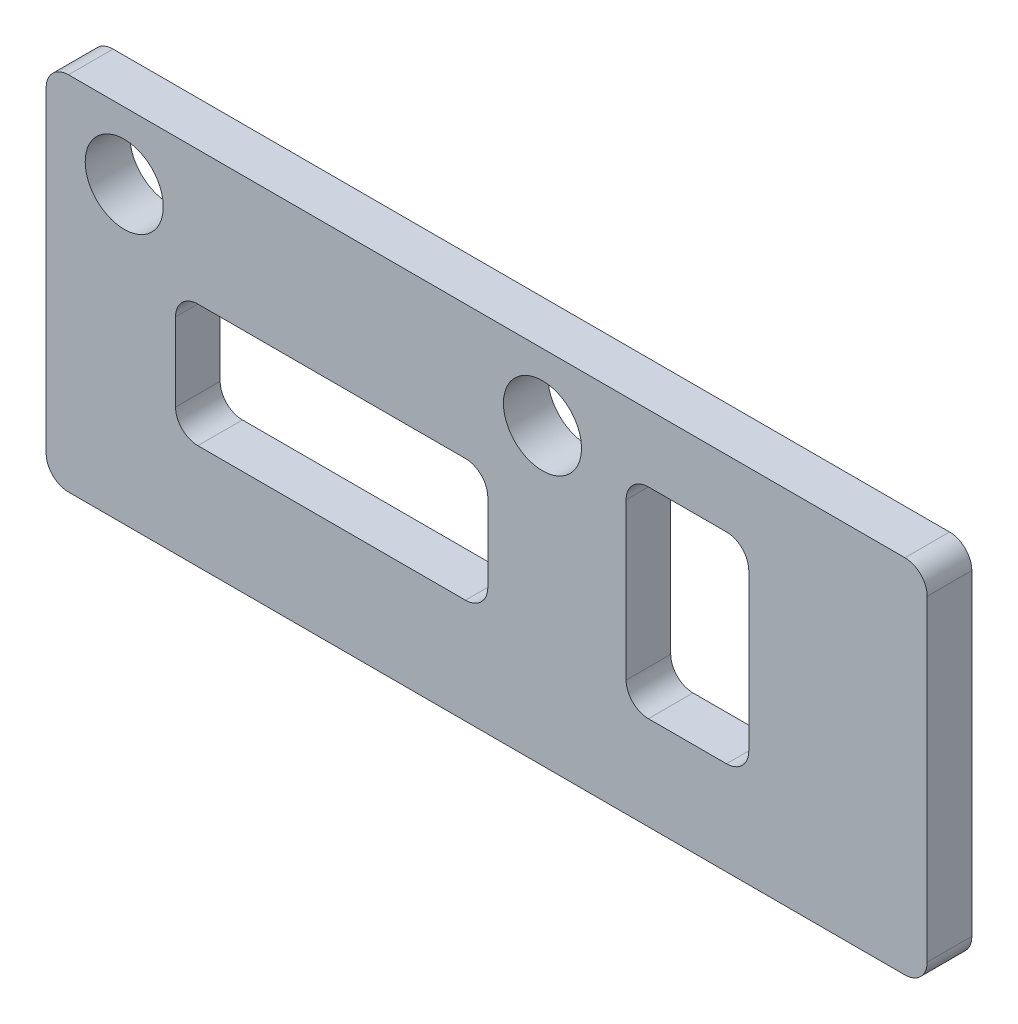
from build123d import *

# Parameters (mm, degrees)
SKETCH1_R           = 1.75
BOSS_EXTRUDE1_DEPTH = 2


with BuildPart() as part:
    # Sketch1 → Boss-Extrude1 (new body)
    with BuildSketch(Plane.XY):
        with BuildLine():
            Line((-19.75, 7.1), (-19.75, -7.1))
            ThreePointArc((-19.75, -7.1), (-19.457106781, -7.807106781), (-18.75, -8.1))
            Line((-18.75, -8.1), (18.75, -8.1))
            ThreePointArc((18.75, -8.1), (19.457106781, -7.807106781), (19.75, -7.1))
            Line((19.75, -7.1), (19.75, 7.1))
            ThreePointArc((19.75, 7.1), (19.457106781, 7.807106781), (18.75, 8.1))
            Line((18.75, 8.1), (-18.75, 8.1))
            ThreePointArc((-18.75, 8.1), (-19.457106781, 7.807106781), (-19.75, 7.1))
        make_face()
        with Locations(Location((-16.25, 5.1, 0), (0, 0, 180))):
            Circle(SKETCH1_R, mode=Mode.SUBTRACT)
        with Locations(Location((2.5, 5.1, 0), (0, 0, 180))):
            Circle(SKETCH1_R, mode=Mode.SUBTRACT)
        with BuildLine():
            Line((7.25, 5.1), (10.75, 5.1))
            ThreePointArc((10.75, 5.1), (11.457106781, 4.807106781), (11.75, 4.1))
            Line((11.75, 4.1), (11.75, -2.9))
            ThreePointArc((11.75, -2.9), (11.457106781, -3.607106781), (10.75, -3.9))
            Line((10.75, -3.9), (7.25, -3.9))
            ThreePointArc((7.25, -3.9), (6.542893219, -3.607106781), (6.25, -2.9))
            Line((6.25, -2.9), (6.25, 4.1))
            ThreePointArc((6.25, 4.1), (6.542893219, 4.807106781), (7.25, 5.1))
        make_face(mode=Mode.SUBTRACT)
        with BuildLine():
            Line((-12.95, 2.1), (-0.95, 2.1))
            ThreePointArc((-0.95, 2.1), (-0.242893219, 1.807106781), (0.05, 1.1))
            Line((0.05, 1.1), (0.05, -2.4))
            ThreePointArc((0.05, -2.4), (-0.242893219, -3.107106781), (-0.95, -3.4))
            Line((-0.95, -3.4), (-12.95, -3.4))
            ThreePointArc((-12.95, -3.4), (-13.657106781, -3.107106781), (-13.95, -2.4))
            Line((-13.95, -2.4), (-13.95, 1.1))
            ThreePointArc((-13.95, 1.1), (-13.657106781, 1.807106781), (-12.95, 2.1))
        make_face(mode=Mode.SUBTRACT)
    extrude(amount=-BOSS_EXTRUDE1_DEPTH)


solid = part.part
